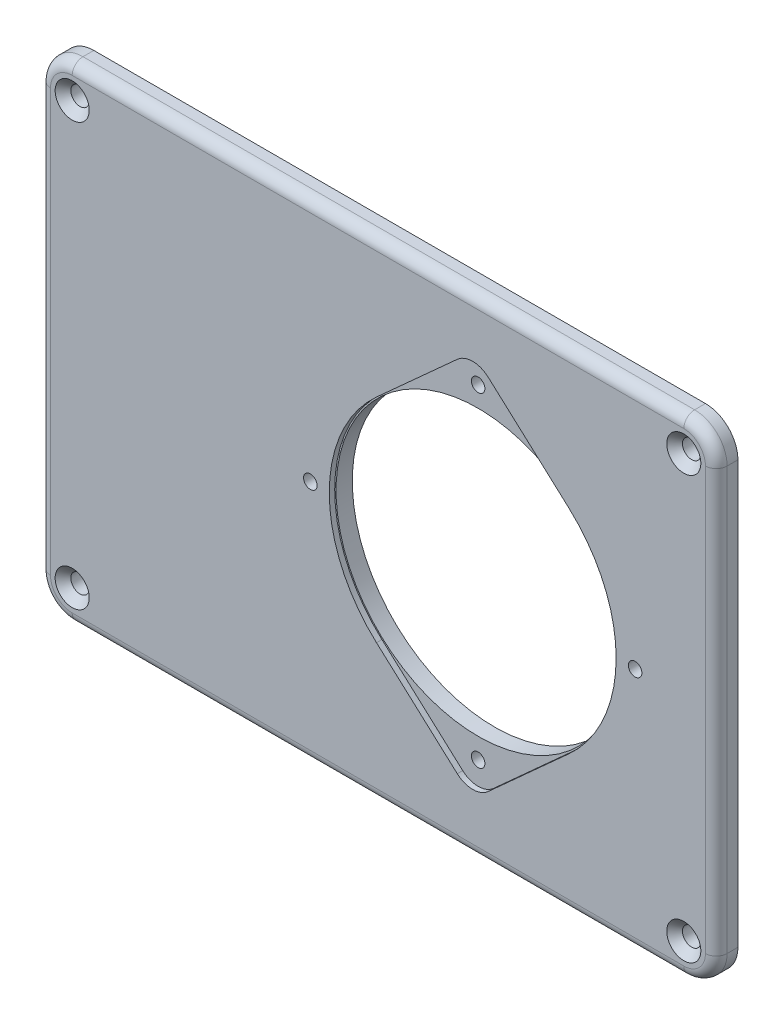
from build123d import *

# Parameters (mm, degrees)
SKETCH1_W                                       = 125
SKETCH1_H                                       = 90
BOSS_EXTRUDE1_DEPTH                             = 4
SKETCH2_R                                       = 26.25
CUT_EXTRUDE2_DEPTH                              = 78.11841544
FILLET1_R                                       = 6
FILLET2_R                                       = 2
CSK_FOR_M3_FLAT_HEAD_MACHINE_SCREW1_D           = 3.4
CSK_FOR_M3_FLAT_HEAD_MACHINE_SCREW1_CSINK_D     = 6.3
CSK_FOR_M3_FLAT_HEAD_MACHINE_SCREW1_CSINK_ANGLE = 90
CUT_EXTRUDE3_DEPTH                              = 1
M3X0_5_TAPPED_HOLE1_D                           = 2.5


with BuildPart() as part:
    # Sketch1 → Boss-Extrude1 (new body)
    with BuildSketch(Plane.XY):
        Rectangle(SKETCH1_W, SKETCH1_H)
    extrude(amount=BOSS_EXTRUDE1_DEPTH)

    # Sketch2 → Cut-Extrude2 (cut, through all)
    with BuildSketch(Plane.XY.offset(4)):
        with Locations((17.5, 0)):
            Circle(SKETCH2_R)
    extrude(amount=-CUT_EXTRUDE2_DEPTH, mode=Mode.SUBTRACT)

    # Fillet1
    fillet1_edges = [part.edges().sort_by_distance(p)[0] for p in [
        (-62.5, -45, 2),
        (62.5, -45, 2),
        (62.5, 45, 2),
        (-62.5, 45, 2),
    ]]
    fillet(fillet1_edges, radius=FILLET1_R)

    # Fillet2
    fillet2_edges = [part.edges().sort_by_distance(p)[0] for p in [
        (-60.742640687, 43.242640687, 4),
        (0, 45, 4),
        (60.742640687, 43.242640687, 4),
        (62.5, 0, 4),
        (60.742640687, -43.242640687, 4),
        (0, -45, 4),
        (-60.742640687, -43.242640687, 4),
        (-62.5, 0, 4),
    ]]
    fillet(fillet2_edges, radius=FILLET2_R)

    # CSK for M3 Flat Head Machine Screw1 (through all)
    with Locations(Plane.XY.offset(4)):
        with Locations((-56.5, 39), (56.5, 39), (56.5, -39), (-56.5, -39)):
            CounterSinkHole(CSK_FOR_M3_FLAT_HEAD_MACHINE_SCREW1_D / 2, CSK_FOR_M3_FLAT_HEAD_MACHINE_SCREW1_CSINK_D / 2, counter_sink_angle=CSK_FOR_M3_FLAT_HEAD_MACHINE_SCREW1_CSINK_ANGLE)

    # Sketch2<5> → Cut-Extrude3 (cut)
    with BuildSketch(Plane.XY.offset(4)):
        with BuildLine():
            Line((-0.275368706, 19.654166667), (14.649233321, 33.152083333))
            ThreePointArc((14.649233321, 33.152083333), (17.5, 34.25), (20.350766679, 33.152083333))
            Line((20.350766679, 33.152083333), (35.275368706, 19.654166667))
            ThreePointArc((35.275368706, 19.654166667), (44, 0), (35.275368706, -19.654166667))
            Line((35.275368706, -19.654166667), (20.350766679, -33.152083333))
            ThreePointArc((20.350766679, -33.152083333), (17.5, -34.25), (14.649233321, -33.152083333))
            Line((14.649233321, -33.152083333), (-0.275368706, -19.654166667))
            ThreePointArc((-0.275368706, -19.654166667), (-9, 0), (-0.275368706, 19.654166667))
        make_face()
    extrude(amount=-CUT_EXTRUDE3_DEPTH, mode=Mode.SUBTRACT)

    # M3x0.5 Tapped Hole1 (through all)
    with Locations(Plane.XY.offset(4)):
        with Locations((17.5, 30), (47.5, 0), (17.5, -30), (-12.5, 0)):
            Hole(M3X0_5_TAPPED_HOLE1_D / 2)


solid = part.part
